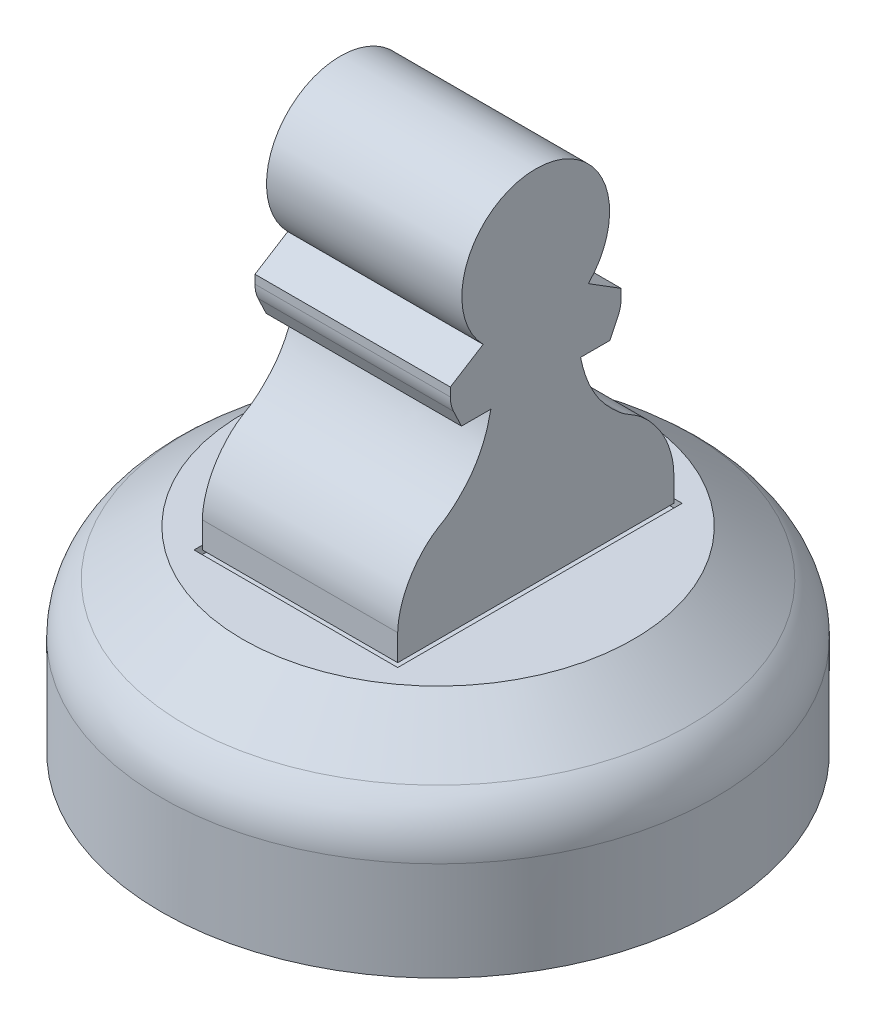
from build123d import *

# Parameters (mm, degrees)
SKETCH1_R           = 13.49375
BOSS_EXTRUDE1_DEPTH = 6.35
SKETCH2_W           = 12.9032
SKETCH2_H           = 19.2532
CUT_EXTRUDE1_DEPTH  = 4.7625
FILLET1_R           = 3.175
BOSS_EXTRUDE2_DEPTH = 4.7625
FILLET3_R           = 1.5875
SKETCH6_W           = 9.9314
SKETCH6_H           = 13.8684
CUT_EXTRUDE2_DEPTH  = 0.396875
SKETCH9_W           = 2.5908
SKETCH9_H           = 22.253441323


with BuildPart() as part:
    # Sketch1 → Boss-Extrude1 (new body)
    with BuildSketch(Plane(origin=(0, 0, 0), x_dir=(1, 0, 0), z_dir=(0, 1, 0))):
        with Locations(Location((0, 0, 0), (0, 0, 270))):
            Circle(SKETCH1_R)
    extrude(amount=BOSS_EXTRUDE1_DEPTH)

    # Sketch2 → Cut-Extrude1 (cut)
    with BuildSketch(Plane.XZ):
        Rectangle(SKETCH2_W, SKETCH2_H)
    extrude(amount=-CUT_EXTRUDE1_DEPTH, mode=Mode.SUBTRACT)

    # Sketch4 → Revolve1 (revolve)
    with BuildSketch(Plane.XY, mode=Mode.PRIVATE) as revolve1_sk:
        Polygon((-13.49375, 6.35), (-9.525, 9.525), (0, 9.525), (0, 6.35), align=None)
    revolve(revolve1_sk.sketch.rotate(Axis((0, 9.525, 0), (0, -1, 0)), 270), axis=Axis((0, 9.525, 0), (0, -1, 0)))

    # Fillet1
    fillet1_edges = [part.edges().sort_by_distance(p)[0] for p in [
        (0, 6.35, -13.49375),
    ]]
    fillet(fillet1_edges, radius=FILLET1_R)

    # Sketch6 → Cut-Extrude2 (cut)
    with BuildSketch(Plane(origin=(0, 9.525, 0), x_dir=(1, 0, 0), z_dir=(0, 1, 0))):
        Rectangle(SKETCH6_W, SKETCH6_H)
    extrude(amount=-CUT_EXTRUDE2_DEPTH, mode=Mode.SUBTRACT)

    # Sketch9 → #6 (0.204) Diameter Hole1 (revolve, cut)
    with BuildSketch(Plane(origin=(0, 4.7625, 0), x_dir=(0, 0, -1), z_dir=(1, 0, 0))):
        with Locations((1.2954, 11.126720662)):
            Rectangle(SKETCH9_W, SKETCH9_H)
    revolve(axis=Axis((0, -1.5875, 0), (0, 1, 0)), mode=Mode.SUBTRACT)


with BuildPart() as body_2:
    # Sketch5 → Boss-Extrude2 (new, symmetric)
    with BuildSketch(Plane(origin=(0, 0, 0), x_dir=(0, 0, -1), z_dir=(1, 0, 0))):
        with BuildLine():
            Line((-6.731, 9.525), (6.731, 9.525))
            Line((6.731, 9.525), (6.731, 10.795))
            add(Edge.make_bspline(
                [(6.731, 10.795), (6.731, 11.024131927), (6.649606127, 11.602687461), (6.358131175, 12.470647258), (5.808408605, 13.330145179), (5.232553241, 13.930163377), (4.735621925, 14.267193507), (4.365875944, 14.466973106), (3.991208167, 14.763542309), (3.585608323, 15.152405246), (3.167726873, 15.621045959), (2.83552458, 16.138033377), (2.44918748, 16.909764468), (2.273183873, 17.531735358), (2.185216272, 17.959882493)],
                knots=[0, 0, 0, 0, 0.07817942, 0.198071141, 0.30964197, 0.424067637, 0.479109808, 0.514035466, 0.567359704, 0.641472425, 0.705863071, 0.781200872, 0.85049795, 1, 1, 1, 1], degree=3))
            Line((2.185216272, 17.959882493), (3.620759547, 17.959882493))
            Line((3.620759547, 17.959882493), (4.164758741, 19.106873992))
            Line((4.164758741, 19.106873992), (4.164758741, 19.884034181))
            Line((4.164758741, 19.884034181), (2.565705919, 20.885069842))
            ThreePointArc((2.565705919, 20.885069842), (0, 27.015941323), (-2.565705919, 20.885069842))
            Line((-2.565705919, 20.885069842), (-4.164758741, 19.884034181))
            Line((-4.164758741, 19.884034181), (-4.164758741, 19.106873992))
            Line((-4.164758741, 19.106873992), (-3.620759547, 17.959882493))
            Line((-3.620759547, 17.959882493), (-2.185216272, 17.959882493))
            add(Edge.make_bspline(
                [(-6.731, 10.795), (-6.731, 11.024131927), (-6.649606127, 11.602687461), (-6.358131175, 12.470647258), (-5.808408605, 13.330145179), (-5.232553241, 13.930163377), (-4.735621925, 14.267193507), (-4.365875944, 14.466973106), (-3.991208167, 14.763542309), (-3.585608323, 15.152405246), (-3.167726873, 15.621045959), (-2.83552458, 16.138033377), (-2.44918748, 16.909764468), (-2.273183873, 17.531735358), (-2.185216272, 17.959882493)],
                knots=[0, 0, 0, 0, 0.07817942, 0.198071141, 0.30964197, 0.424067637, 0.479109808, 0.514035466, 0.567359704, 0.641472425, 0.705863071, 0.781200872, 0.85049795, 1, 1, 1, 1], degree=3))
            Line((-6.731, 10.795), (-6.731, 9.525))
        make_face()
    extrude(amount=BOSS_EXTRUDE2_DEPTH, both=True)

    # Fillet3
    fillet3_edges = [body_2.edges().sort_by_distance(p)[0] for p in [
        (0, 19.106873992, 4.164758741),
        (0, 19.106873992, -4.164758741),
    ]]
    fillet(fillet3_edges, radius=FILLET3_R)


solid = Compound([part.part, body_2.part])
